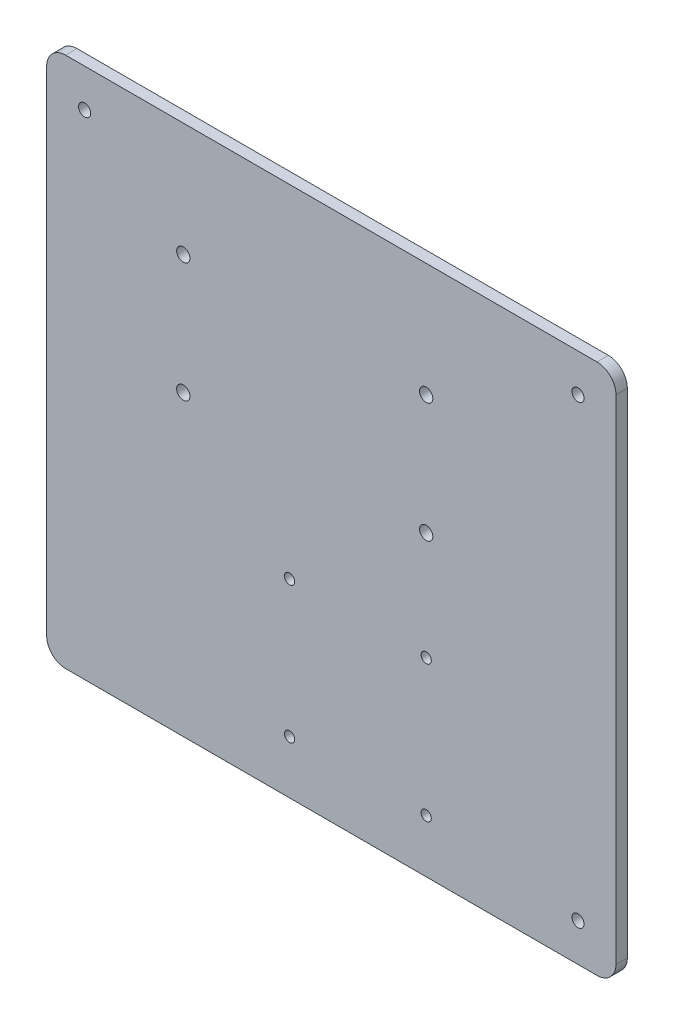
from build123d import *

# Parameters (mm, degrees)
SKETCH_1_W          = 150
SKETCH_1_H          = 140
EXTRUDE_1_DEPTH     = 3
SKETCH_3_R          = 1.75
CUT_EXTRUDE_1_DEPTH = 10
SKETCH_4_R          = 1.35
CUT_EXTRUDE_2_DEPTH = 10
SKETCH_5_R          = 1.6
CUT_EXTRUDE_3_DEPTH = 10
FILLET_1_R          = 5


with BuildPart() as part:
    # 草图1 → 凸台-拉伸1 (new body)
    with BuildSketch(Plane.XY):
        Rectangle(SKETCH_1_W, SKETCH_1_H)
    extrude(amount=EXTRUDE_1_DEPTH)

    # 草图3 → 切除-拉伸1 (cut)
    with BuildSketch(Plane.XY.offset(3)):
        with Locations((25, 40)):
            Circle(SKETCH_3_R)
        with Locations((-39, 40)):
            Circle(SKETCH_3_R)
        with Locations((25, 8.5)):
            Circle(SKETCH_3_R)
        with Locations((-39, 8.5)):
            Circle(SKETCH_3_R)
    extrude(amount=-CUT_EXTRUDE_1_DEPTH, mode=Mode.SUBTRACT)

    # 草图4 → 切除-拉伸2 (cut)
    with BuildSketch(Plane.XY.offset(3)):
        with Locations((25, -20)):
            Circle(SKETCH_4_R)
        with Locations((-11, -20)):
            Circle(SKETCH_4_R)
        with Locations((-11, -56)):
            Circle(SKETCH_4_R)
        with Locations((25, -56)):
            Circle(SKETCH_4_R)
    extrude(amount=-CUT_EXTRUDE_2_DEPTH, mode=Mode.SUBTRACT)

    # 草图5 → 切除-拉伸3 (cut)
    with BuildSketch(Plane.XY.offset(3)):
        with Locations((65, 60)):
            Circle(SKETCH_5_R)
        with Locations((-65, 60)):
            Circle(SKETCH_5_R)
        with Locations((65, -60)):
            Circle(SKETCH_5_R)
    extrude(amount=-CUT_EXTRUDE_3_DEPTH, mode=Mode.SUBTRACT)

    # 圆角1
    fillet_1_edges = [part.edges().sort_by_distance(p)[0] for p in [
        (75, -70, 1.5),
        (-75, -70, 1.5),
        (-75, 70, 1.5),
        (75, 70, 1.5),
    ]]
    fillet(fillet_1_edges, radius=FILLET_1_R)


solid = part.part
